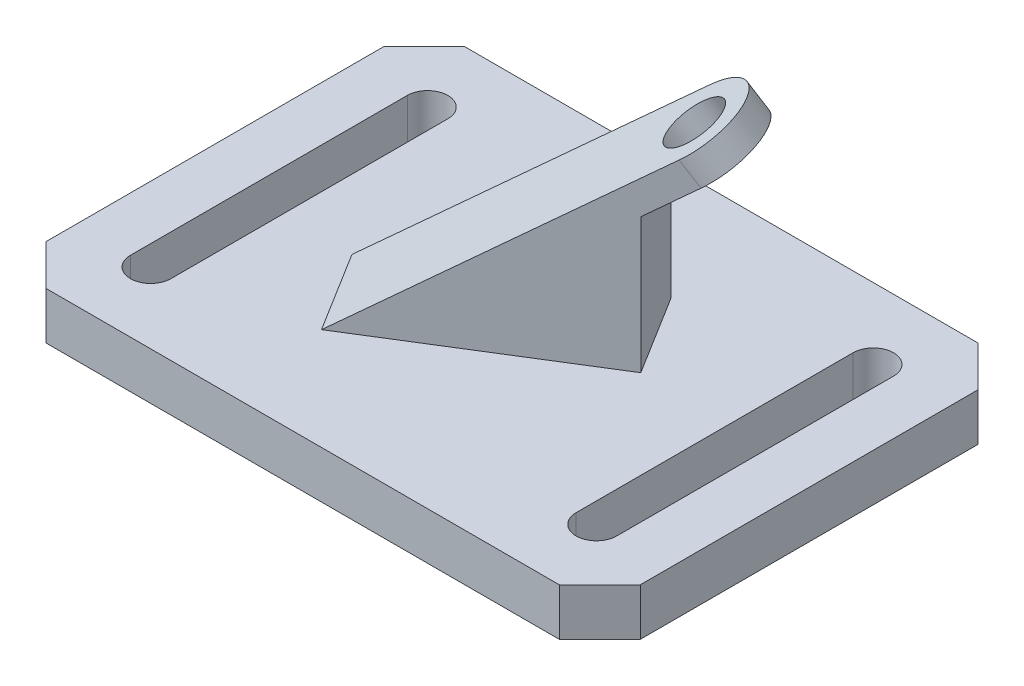
from build123d import *

# Parameters (mm, degrees)
BOSS_EXTRUDE1_DEPTH = 7
BOSS_EXTRUDE2_DEPTH = 7
SKETCH4_R           = 4
BOSS_EXTRUDE5_DEPTH = 4


with BuildPart() as part:
    # Sketch1 → Boss-Extrude1 (new body)
    with BuildSketch(Plane(origin=(0, 0, 0), x_dir=(1, 0, 0), z_dir=(0, 1, 0))):
        Polygon((38, -31), (-38, -31), (-44, -25), (-44, 25), (-38, 31), (38, 31), (44, 25), (44, -25), align=None)
        with BuildLine():
            Line((-36, -20.5), (-36, 20.5))
            ThreePointArc((-36, 20.5), (-33, 23.5), (-30, 20.5))
            Line((-30, 20.5), (-30, -20.5))
            ThreePointArc((-30, -20.5), (-33, -23.5), (-36, -20.5))
        make_face(mode=Mode.SUBTRACT)
        with BuildLine():
            Line((30, -20.5), (30, 20.5))
            ThreePointArc((30, 20.5), (33, 23.5), (36, 20.5))
            Line((36, 20.5), (36, -20.5))
            ThreePointArc((36, -20.5), (33, -23.5), (30, -20.5))
        make_face(mode=Mode.SUBTRACT)
    extrude(amount=BOSS_EXTRUDE1_DEPTH)

    # Sketch2 → Boss-Extrude2 (add, symmetric)
    with BuildSketch(Plane(origin=(0, 0, 0), x_dir=(0.8494412510349068, 0, -0.5276832014004735), z_dir=(0.5276832014004734, 0, 0.8494412510349066))):
        Polygon((15.483777963, 7), (15.483777963, 27), (-12.043860446, 7), align=None)
    extrude(amount=BOSS_EXTRUDE2_DEPTH, both=True)

    # Sketch4 → Boss-Extrude5 (add)
    with BuildSketch(Plane(origin=(-6.362101975, 10.30875546, 3.952214863), x_dir=(0.8664354877824215, 0.46620126275894386, 0.1787342387826231), z_dir=(-0.499289040047183, 0.8090169943749506, 0.310164403665675))):
        with BuildLine():
            Line((-13.486874593, -1.530456574), (-4.960486969, -12.634542043))
            Line((-4.960486969, -12.634542043), (33.131310727, 16.614641364))
            ThreePointArc((33.131310727, 16.614641364), (34.42015965, 26.42987791), (24.604923104, 27.718726833))
            Line((24.604923104, 27.718726833), (-13.486874593, -1.530456574))
        make_face()
        with Locations((28.868116916, 22.166684098)):
            Circle(SKETCH4_R, mode=Mode.SUBTRACT)
    extrude(amount=BOSS_EXTRUDE5_DEPTH)


solid = part.part
